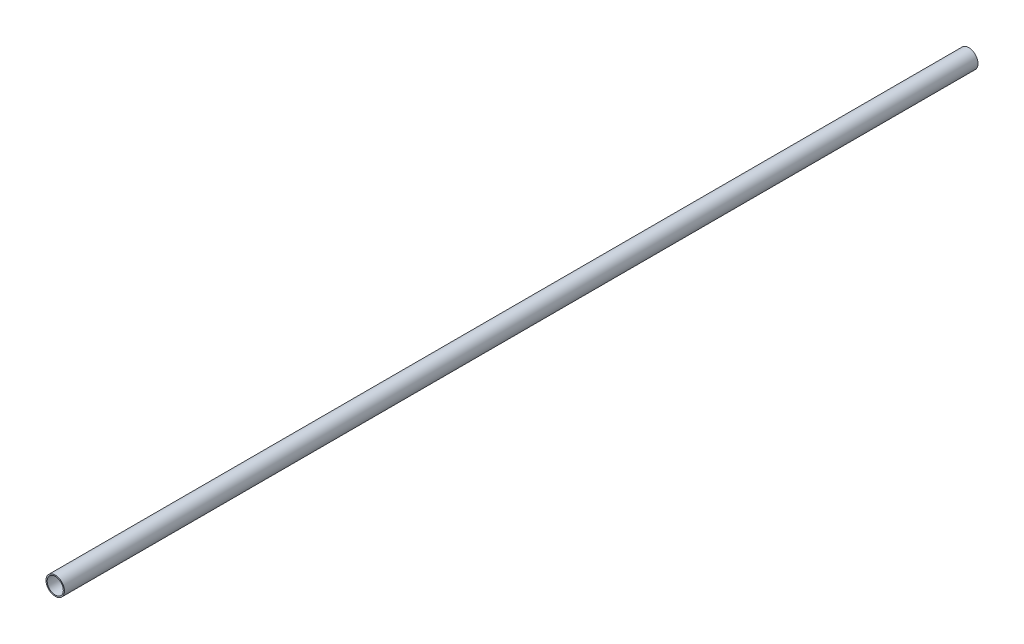
from build123d import *

# Parameters (mm, degrees)
EXTRUDE_START        = -196.788957724
EXTRUDE_SKETCH_1_R   = 30.15
EXTRUDE_SKETCH_1_R_2 = 26.24
EXTRUDE_1_DEPTH      = 2978


with BuildPart() as part:
    # Extrude sketch 1 → Extrude 1 (new body)
    with BuildSketch(Plane.XY.offset(EXTRUDE_START)):
        Circle(EXTRUDE_SKETCH_1_R)
        Circle(EXTRUDE_SKETCH_1_R_2, mode=Mode.SUBTRACT)
    extrude(amount=EXTRUDE_1_DEPTH)


solid = part.part
